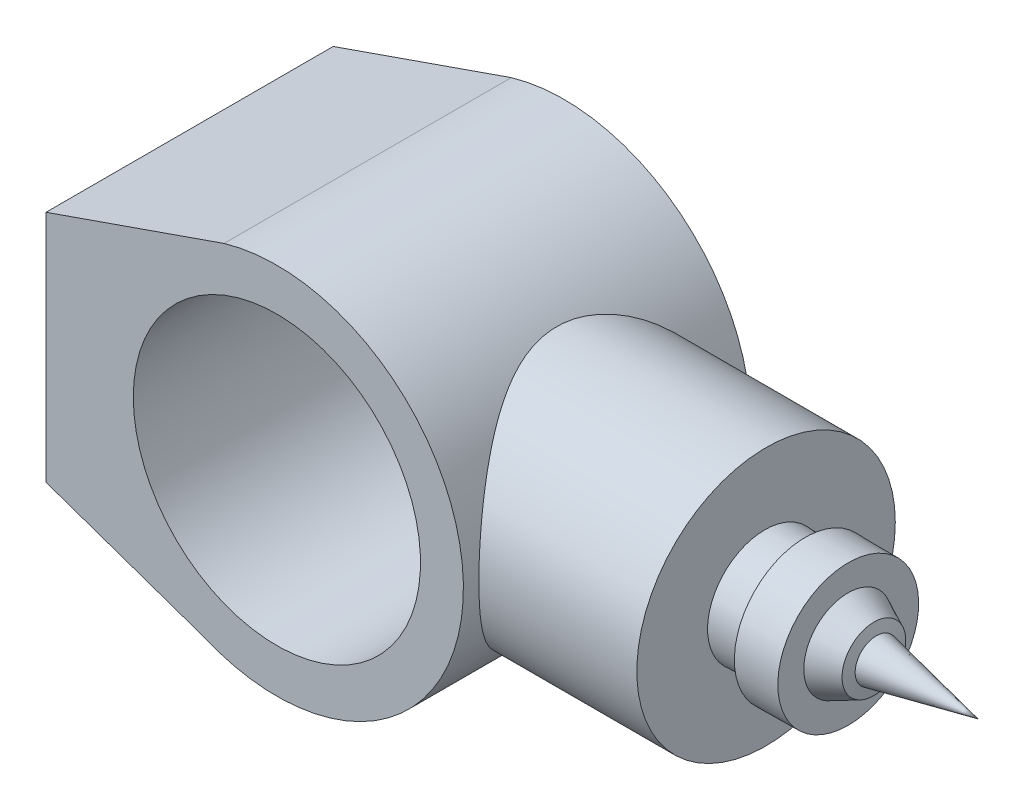
from build123d import *

# Parameters (mm, degrees)
SKETCH1_R                = 50
BOSS_EXTRUDE1_DEPTH      = 50
BOSS_EXTRUDE2_REACH      = 218.485
BOSS_EXTRUDE2_END_RADIUS = 65
SKETCH2_R                = 45


with BuildPart() as part:
    # Sketch1 → Boss-Extrude1 (new, symmetric)
    with BuildSketch(Plane.XY):
        with BuildLine():
            Line((-80.332774103, 40.816671374), (-18.32732241, 62.420380787))
            ThreePointArc((-18.32732241, 62.420380787), (64.887320327, -3.869658553), (-25.718765207, -59.633296758))
            Line((-25.718765207, -59.633296758), (-80.331207523, -40.594442176))
            Line((-80.331207523, -40.594442176), (-80.332774103, 40.816671374))
        make_face()
        with Locations(Location((0.059475093, 0.33297887, 0), (0, 0, 180))):
            Circle(SKETCH1_R, mode=Mode.SUBTRACT)
    extrude(amount=BOSS_EXTRUDE1_DEPTH, both=True)

    # Boss-Extrude2: up to this cylinder (the profile starts outside it)
    boss_extrude2_end = Plane(origin=(0.006183555, 0.059475093, -0.380635), z_dir=(0, 0, -1)) * Cylinder(BOSS_EXTRUDE2_END_RADIUS, 567.97, mode=Mode.PRIVATE)
    # Sketch2 → Boss-Extrude2 (add, up to the surface)
    with BuildSketch(Plane(origin=(120, 0, 0), x_dir=(0, 0, -1), z_dir=(1, 0, 0)), mode=Mode.PRIVATE) as boss_extrude2_sk1:
        with Locations((0.380634668, -0.130842241)):
            Circle(SKETCH2_R)
    boss_extrude2_tool1 = extrude(boss_extrude2_sk1.sketch, amount=-BOSS_EXTRUDE2_REACH, mode=Mode.PRIVATE) - boss_extrude2_end
    add(boss_extrude2_tool1.solids().sort_by_distance((120, -0.130842, -0.380635))[0])

    # Sketch4 → Revolve1 (revolve)
    with BuildSketch(Plane.XY):
        Polygon((119.999333132, 0.283284997), (194.173107585, 0.294264183), (158.779171315, -7.089790216), (157.928859049, -10.799864107), (148.89148066, -15.080727554), (148.998076603, -24.232348433), (133.998076603, -24.369382261), (133.994271745, -19.369382261), (119.994271745, -19.700497331), align=None)
    revolve(axis=Axis((119.999333132, 0.283284997, 0), (0.9999999890450703, 0.00014801979444003187, 0)))


solid = part.part
